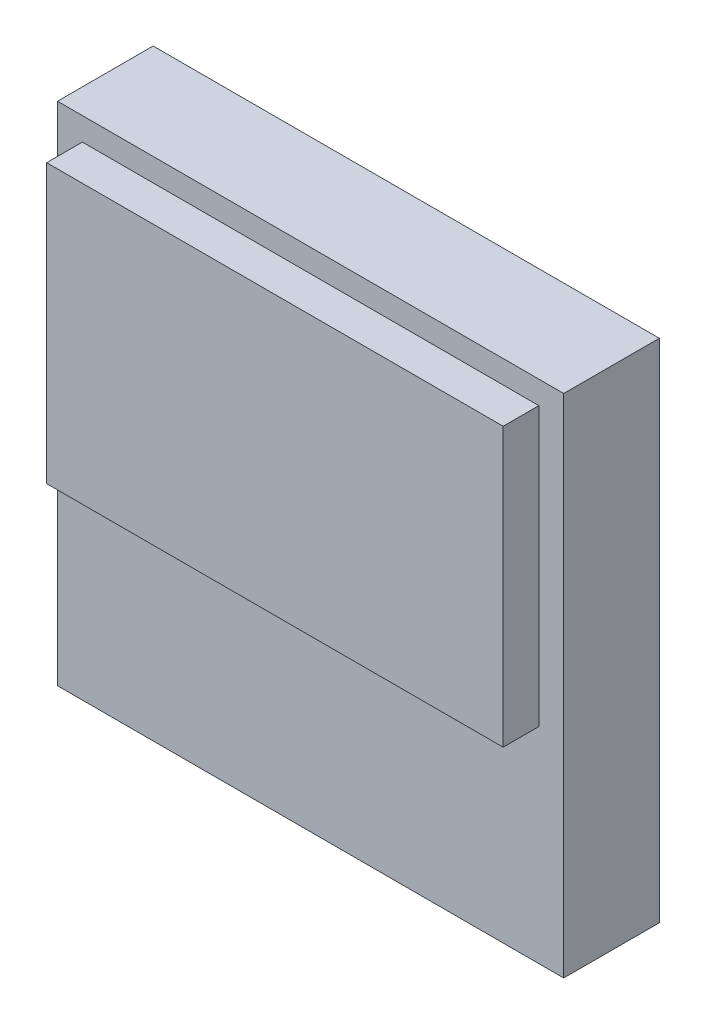
from build123d import *

# Parameters (mm, degrees)
SKETCH1_W           = 39.7
SKETCH1_H           = 39.7
BOSS_EXTRUDE1_DEPTH = 7.5
SKETCH2_W           = 35.8
SKETCH2_H           = 21.8
BOSS_EXTRUDE2_DEPTH = 2.8
SHELL1_T            = -0.5
SKETCH4_W           = 1
SKETCH4_H           = 1
BOSS_EXTRUDE3_DEPTH = 5
SKETCH5_W           = 1
SKETCH5_H           = 1
BOSS_EXTRUDE4_DEPTH = 5
SKETCH6_W           = 38.7
SKETCH6_H           = 15.557355087
BOSS_EXTRUDE5_DEPTH = 0.1


with BuildPart() as part:
    # Sketch1 → Boss-Extrude1 (new body)
    with BuildSketch(Plane.XY):
        Rectangle(SKETCH1_W, SKETCH1_H)
    extrude(amount=BOSS_EXTRUDE1_DEPTH)

    # Sketch2 → Boss-Extrude2 (add)
    with BuildSketch(Plane.XY.offset(7.5)):
        with Locations((0, 7.15)):
            Rectangle(SKETCH2_W, SKETCH2_H)
    extrude(amount=BOSS_EXTRUDE2_DEPTH)

    # Shell1
    shell1_openings = [part.faces().sort_by_distance(p)[0] for p in [
        (0, 0, 0),
    ]]
    offset(amount=SHELL1_T, openings=shell1_openings, kind=Kind.INTERSECTION)

    # Sketch4 → Boss-Extrude3 (add)
    with BuildSketch(Plane(origin=(0, 0, 7), x_dir=(-1, 0, 0), z_dir=(0, 0, -1))):
        with Locations((-11, 18.85)):
            Rectangle(SKETCH4_W, SKETCH4_H)
        with Locations((11, 18.85)):
            Rectangle(SKETCH4_W, SKETCH4_H)
    boss_extrude3 = extrude(amount=BOSS_EXTRUDE3_DEPTH)

    # Mirror1: Boss-Extrude3 across plane
    add(boss_extrude3.mirror(Plane.ZX))

    # Sketch5 → Boss-Extrude4 (add)
    with BuildSketch(Plane(origin=(0, 0, 7), x_dir=(-1, 0, 0), z_dir=(0, 0, -1))):
        with Locations((-18.85, -7.35)):
            Rectangle(SKETCH5_W, SKETCH5_H)
        with Locations((18.85, -7.35)):
            Rectangle(SKETCH5_W, SKETCH5_H)
    extrude(amount=BOSS_EXTRUDE4_DEPTH)

    # Sketch6 → Boss-Extrude5 (add)
    with BuildSketch(Plane(origin=(0, 0, 7), x_dir=(-1, 0, 0), z_dir=(0, 0, -1))):
        with Locations((0, -11.571322457)):
            Rectangle(SKETCH6_W, SKETCH6_H)
    extrude(amount=BOSS_EXTRUDE5_DEPTH)


solid = part.part
